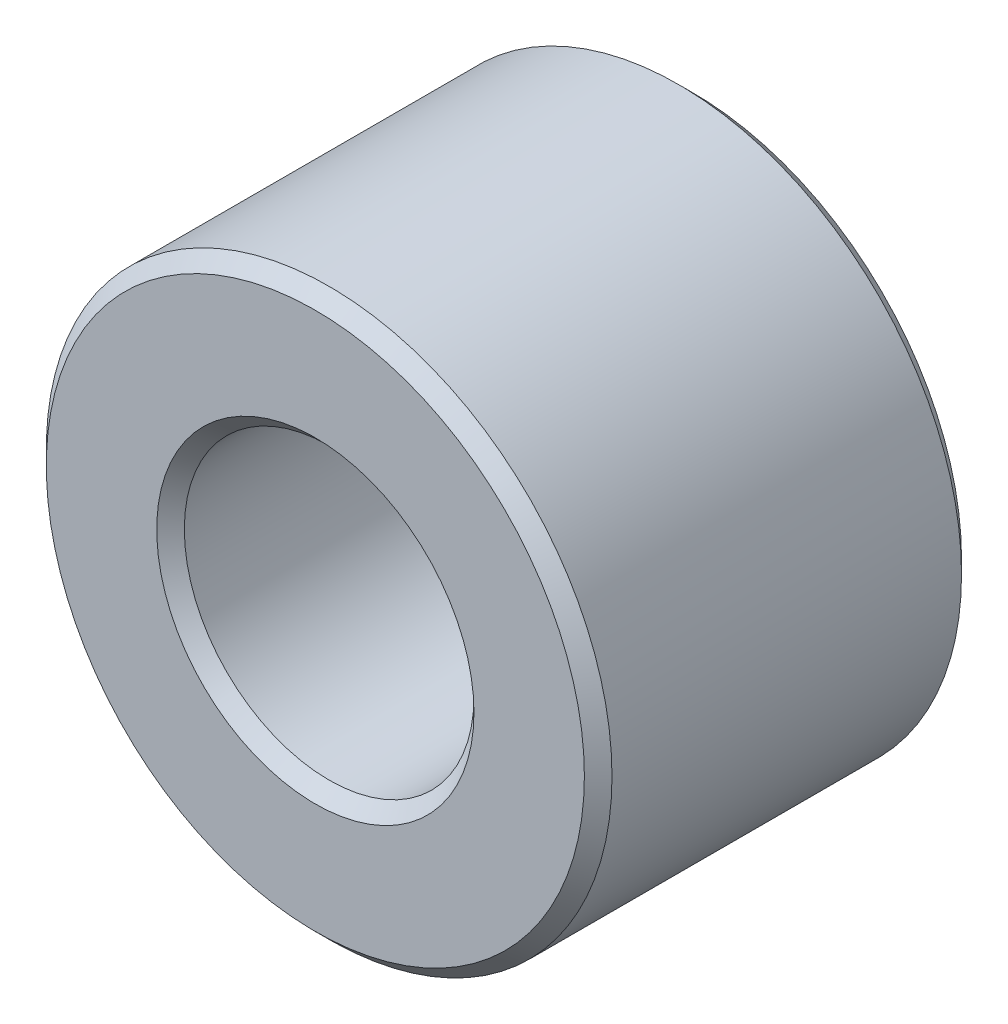
from build123d import *

# Parameters (mm, degrees)
BOSS_EXTRUDE1_DEPTH      = 3.175
BOSS_EXTRUDE1_DEPTH_BACK = 3.175
SKETCH3_R                = 4.7625
SKETCH3_R_2              = 2.4384
CHAMFER1_SIZE            = 0.23241


with BuildPart() as part:
    # Sketch3 → Boss-Extrude1 (new, two sides: drawn at the far end of the back side and taken through both)
    with BuildSketch(Plane.XY.offset(-BOSS_EXTRUDE1_DEPTH_BACK)):
        Circle(SKETCH3_R)
        Circle(SKETCH3_R_2, mode=Mode.SUBTRACT)
    extrude(amount=BOSS_EXTRUDE1_DEPTH + BOSS_EXTRUDE1_DEPTH_BACK)

    # Chamfer1
    chamfer1_edges = [part.edges().sort_by_distance(p)[0] for p in [
        (-4.7625, 0, -3.175),
        (-2.4384, 0, -3.175),
        (-4.7625, 0, 3.175),
        (-2.4384, 0, 3.175),
    ]]
    chamfer(chamfer1_edges, length=CHAMFER1_SIZE)


solid = part.part
